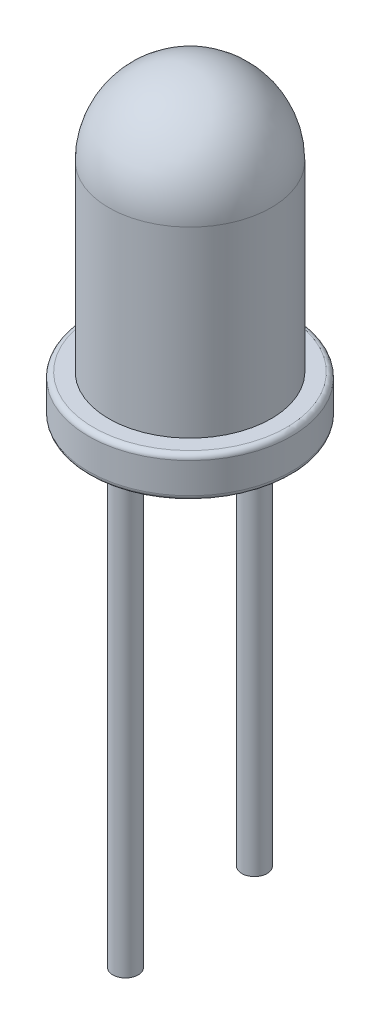
from build123d import *

# Parameters (mm, degrees)
FILLET1_R           = 0.1
SKETCH2_R           = 0.25
BOSS_EXTRUDE1_DEPTH = 10
SKETCH3_R           = 0.25
BOSS_EXTRUDE2_DEPTH = 7


with BuildPart() as part:
    # Sketch1 → Revolve6 (revolve)
    with BuildSketch(Plane.XY, mode=Mode.PRIVATE) as revolve6_sk:
        with BuildLine():
            Line((-2, 0), (0, 0))
            Line((0, 0), (0, 6))
            ThreePointArc((0, 6), (-1.13137085, 5.53137085), (-1.6, 4.4))
            Line((-1.6, 4.4), (-1.6, 0.8))
            Line((-1.6, 0.8), (-2, 0.8))
            Line((-2, 0.8), (-2, 0))
        make_face()
    revolve(revolve6_sk.sketch.rotate(Axis((0, 8.598320721, 0), (0, -1, 0)), 270), axis=Axis((0, 8.598320721, 0), (0, -1, 0)))

    # Fillet1
    fillet1_edges = [part.edges().sort_by_distance(p)[0] for p in [
        (0, 0, -2),
        (0, 0.8, -2),
    ]]
    fillet(fillet1_edges, radius=FILLET1_R)

    # Sketch2 → Boss-Extrude1 (add)
    with BuildSketch(Plane.XZ):
        with Locations(Location((-1.27, 0, 0), (0, 0, 90))):
            Circle(SKETCH2_R)
    extrude(amount=BOSS_EXTRUDE1_DEPTH)

    # Sketch3 → Boss-Extrude2 (add)
    with BuildSketch(Plane.XZ):
        with Locations(Location((1.27, 0, 0), (0, 0, 90))):
            Circle(SKETCH3_R)
    extrude(amount=BOSS_EXTRUDE2_DEPTH)


solid = part.part
